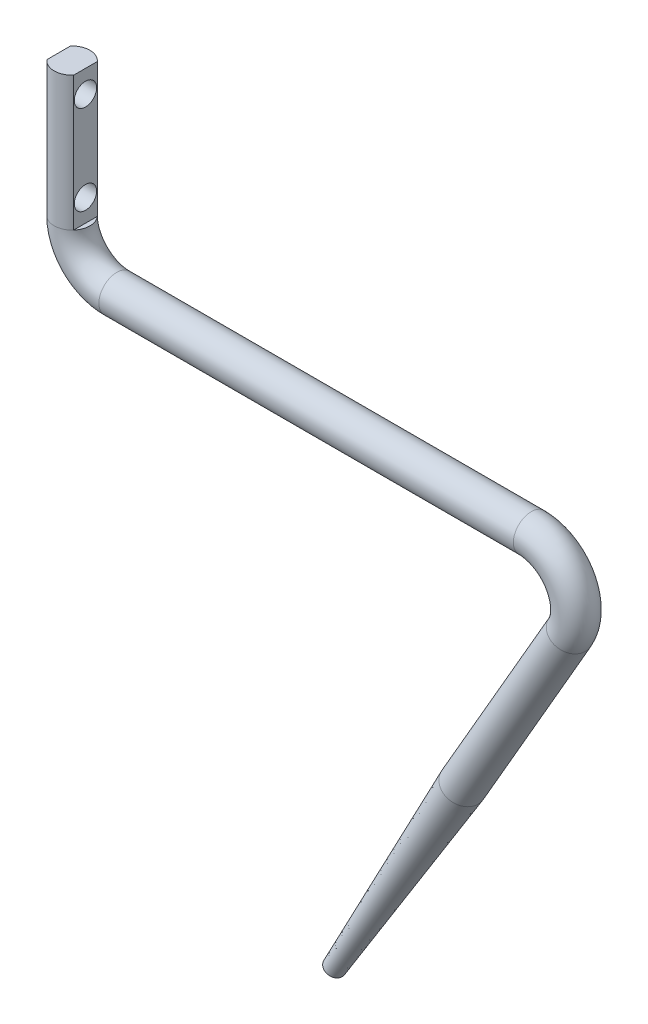
from build123d import *

# Parameters (mm, degrees)
SKETCH3_R             = 4
CHAMFER1_SIZE         = 2
CHAMFER1_SIZE2        = 57.272506566
SKETCH4_OUTSIDE_W     = 160.781
SKETCH4_OUTSIDE_H     = 48.102
SKETCH4_OUTSIDE_W_2   = 6
SKETCH4_OUTSIDE_H_2   = 35.530215116
EXTRUDE1_DEPTH        = 30
M6_TAPPED_HOLE1_D     = 5
M6_TAPPED_HOLE1_DEPTH = 9
M6_TAPPED_HOLE1_TIP   = 1.502151548


with BuildPart() as part:
    # Sweep1: sweep along a path in Sketch1
    with BuildLine(Plane.XY) as sweep1_path:
        Line((0, 40), (0, 10))
        ThreePointArc((0, 10), (2.928932188, 2.928932188), (10, 0))
        Line((10, 0), (102.678729005, 0))
        ThreePointArc((102.678729005, 0), (111.339078403, -5.000165172), (111.338792313, -15.000330339))
        Line((111.338792313, -15.000330339), (58.68, -106.2))
    # Sketch3 → Sweep1 (sweep)
    with BuildSketch(Plane(origin=(0, 40, 0), x_dir=(1, 0, 0), z_dir=(0, 1, 0))):
        Circle(SKETCH3_R)
    sweep(path=sweep1_path.line)

    # Chamfer1
    chamfer1_edges = [part.edges().sort_by_distance(p)[0] for p in [
        (55.215974677, -104.199867864, 0),
    ]]
    chamfer1_side = [part.faces().sort_by_distance(p)[0] for p in [
        (58.68, -106.2, 0),
    ]]
    chamfer(chamfer1_edges, length=CHAMFER1_SIZE, length2=CHAMFER1_SIZE2, reference=chamfer1_side[0])

    # Sketch4 outside → Extrude1 (cut)
    with BuildSketch(Plane(origin=(0, 40, 0), x_dir=(1, 0, 0), z_dir=(0, 1, 0))):
        with Locations((56.3395, 0)):
            Rectangle(SKETCH4_OUTSIDE_W, SKETCH4_OUTSIDE_H)
        Rectangle(SKETCH4_OUTSIDE_W_2, SKETCH4_OUTSIDE_H_2, mode=Mode.SUBTRACT)
    extrude(amount=-EXTRUDE1_DEPTH, mode=Mode.SUBTRACT)

    # M6 Tapped Hole1
    with Locations(Plane(origin=(3, 0, 0), x_dir=(0, 0, -1), z_dir=(1, 0, 0))):
        with Locations((0, 35), (0, 15)):
            Hole(M6_TAPPED_HOLE1_D / 2, depth=M6_TAPPED_HOLE1_DEPTH)
            with Locations((0, 0, -(M6_TAPPED_HOLE1_DEPTH + M6_TAPPED_HOLE1_TIP / 2))):  # 118° drill point
                Cone(0, M6_TAPPED_HOLE1_D / 2, M6_TAPPED_HOLE1_TIP, mode=Mode.SUBTRACT)


solid = part.part
